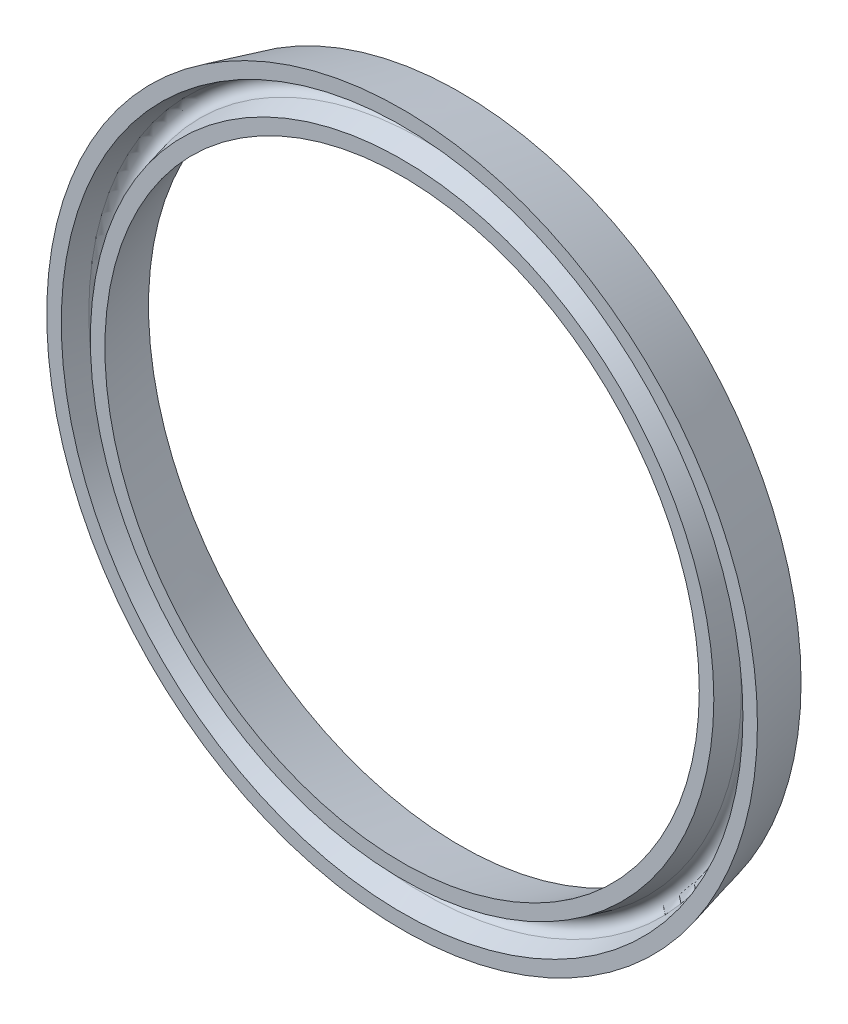
from build123d import *


with BuildPart() as part:
    # Sketch3 → Revolve1 (revolve)
    with BuildSketch(Plane(origin=(0, 0, 0), x_dir=(1, 0, 0), z_dir=(0, 1, 0))):
        with BuildLine():
            Line((-3, -6), (-1.863803438, -1.45521375))
            ThreePointArc((-1.863803438, -1.45521375), (0, 0), (1.863803438, -1.45521375))
            Line((1.863803438, -1.45521375), (3, -6))
            Line((3, -6), (6, -6))
            Line((6, -6), (3, 6))
            Line((3, 6), (-3, 6))
            Line((-3, 6), (-6, -6))
            Line((-6, -6), (-3, -6))
        make_face()
    revolve(axis=Axis((-67.31, 0, 6), (0, 0, -1)))


solid = part.part
